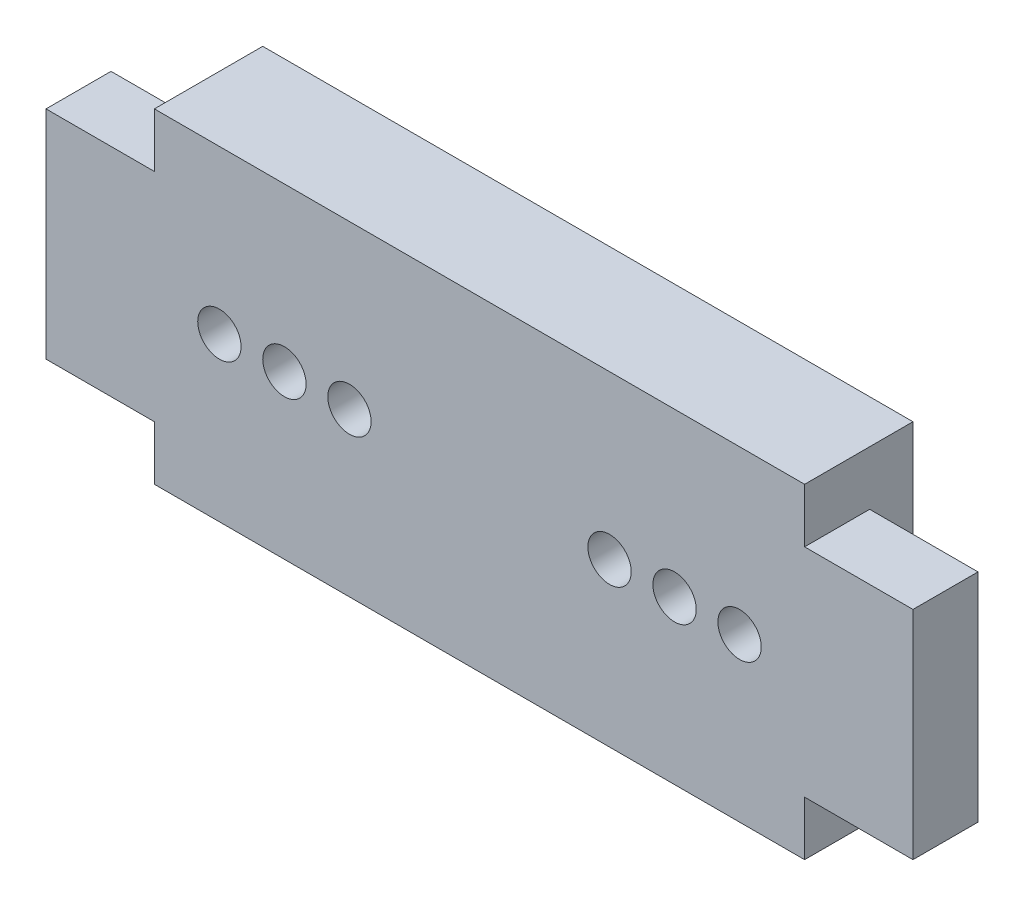
from build123d import *

# Parameters (mm, degrees)
SKETCH1_W           = 30
SKETCH1_H           = 5
BOSS_EXTRUDE1_DEPTH = 15
SKETCH3_R           = 1
CUT_EXTRUDE2_DEPTH  = 5
SKETCH4_R           = 2
CUT_EXTRUDE3_DEPTH  = 1.5
SKETCH5_W           = 5
SKETCH5_H           = 10
BOSS_EXTRUDE2_DEPTH = 3


with BuildPart() as part:
    # Sketch1 → Boss-Extrude1 (new body)
    with BuildSketch(Plane(origin=(0, 0, 0), x_dir=(1, 0, 0), z_dir=(0, 1, 0))):
        with Locations((-41.880536913, 26.290268456)):
            Rectangle(SKETCH1_W, SKETCH1_H)
    extrude(amount=BOSS_EXTRUDE1_DEPTH)

    # Sketch3 → Cut-Extrude2 (cut)
    with BuildSketch(Plane(origin=(0, 0, -28.790268456), x_dir=(-1, 0, 0), z_dir=(0, 0, -1))):
        with Locations((35.880536913, 7.5)):
            Circle(SKETCH3_R)
        with Locations((32.880536913, 7.5)):
            Circle(SKETCH3_R)
        with Locations((29.880536913, 7.5)):
            Circle(SKETCH3_R)
        with Locations((53.880536913, 7.5)):
            Circle(SKETCH3_R)
        with Locations((50.880536913, 7.5)):
            Circle(SKETCH3_R)
        with Locations((47.880536913, 7.5)):
            Circle(SKETCH3_R)
    extrude(amount=-CUT_EXTRUDE2_DEPTH, mode=Mode.SUBTRACT)

    # Sketch4 → Cut-Extrude3 (cut)
    with BuildSketch(Plane(origin=(0, 0, -28.790268456), x_dir=(-1, 0, 0), z_dir=(0, 0, -1))):
        with Locations((41.880536913, 7.5)):
            Circle(SKETCH4_R)
    extrude(amount=-CUT_EXTRUDE3_DEPTH, mode=Mode.SUBTRACT)

    # Sketch5 → Boss-Extrude2 (add)
    with BuildSketch(Plane.XY.offset(-23.790268456)):
        with Locations((-59.380536913, 7.5)):
            Rectangle(SKETCH5_W, SKETCH5_H)
        with Locations((-24.380536913, 7.5)):
            Rectangle(SKETCH5_W, SKETCH5_H)
    extrude(amount=-BOSS_EXTRUDE2_DEPTH)


solid = part.part
